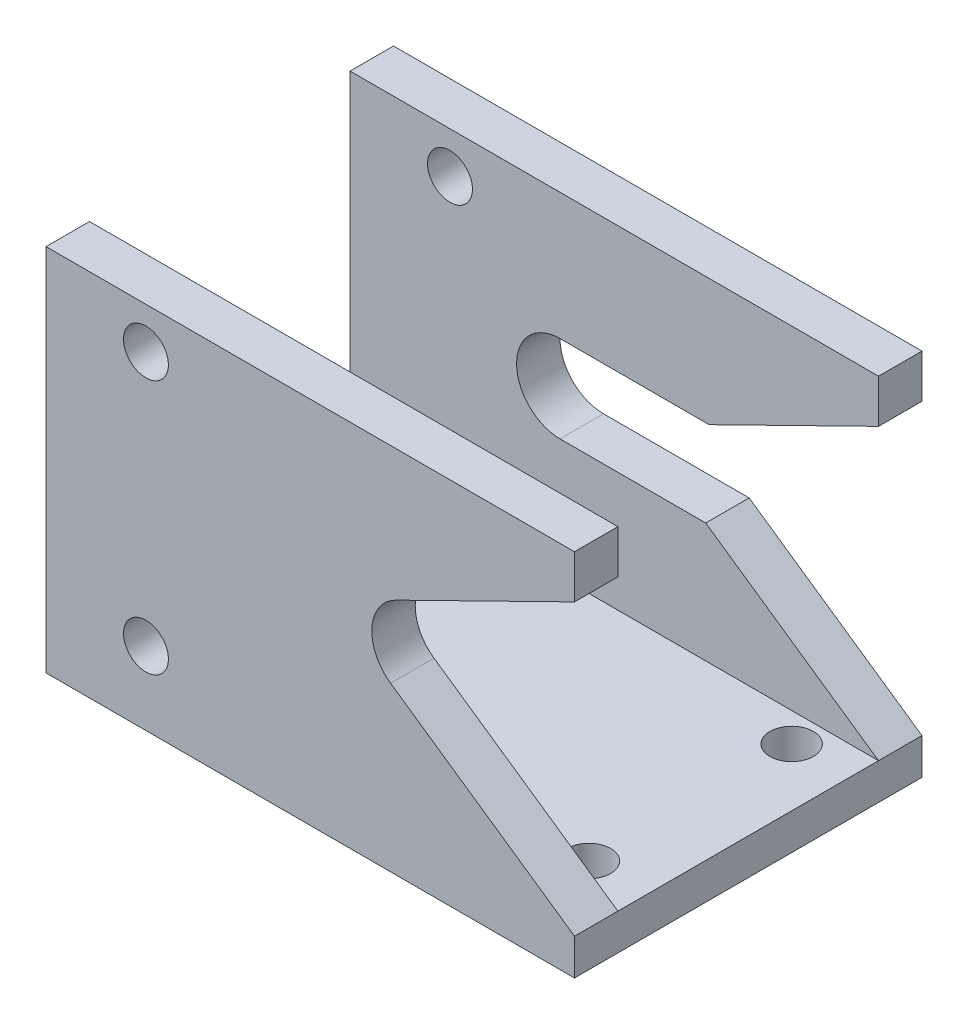
from build123d import *

# Parameters (mm, degrees)
SKETCH1_W           = 36.5
SKETCH1_H           = 24
BOSS_EXTRUDE1_DEPTH = 2.5
SKETCH2_W           = 36.5
SKETCH2_H           = 3
BOSS_EXTRUDE2_DEPTH = 23
SKETCH3_R           = 3
SKETCH3_R_2         = 1.55
CUT_EXTRUDE2_DEPTH  = 51.581617214
SKETCH6_R           = 1.5
CUT_EXTRUDE4_DEPTH  = 50.368512232
CUT_EXTRUDE5_REACH  = 52.582


with BuildPart() as part:
    # Sketch1 → Boss-Extrude1 (new body)
    with BuildSketch(Plane(origin=(0, 0, 0), x_dir=(1, 0, 0), z_dir=(0, 1, 0))):
        with Locations((18.25, 12)):
            Rectangle(SKETCH1_W, SKETCH1_H)
    extrude(amount=BOSS_EXTRUDE1_DEPTH)

    # Sketch2 → Boss-Extrude2 (add)
    with BuildSketch(Plane(origin=(0, 2.5, 0), x_dir=(1, 0, 0), z_dir=(0, 1, 0))):
        with Locations((18.25, 1.5)):
            Rectangle(SKETCH2_W, SKETCH2_H)
        with Locations((18.25, 22.5)):
            Rectangle(SKETCH2_W, SKETCH2_H)
    extrude(amount=BOSS_EXTRUDE2_DEPTH)

    # Sketch3 → Cut-Extrude2 (cut, through all)
    with BuildSketch(Plane.XY):
        with Locations((25.5, 13.75)):
            Circle(SKETCH3_R)
        with BuildLine():
            Line((36.5, 2.5), (36.5, 22.497165255))
            Line((36.5, 22.497165255), (24.17707002, 16.442555713))
            ThreePointArc((24.17707002, 16.442555713), (27.086065897, 16.29644752), (28.5, 13.75))
            ThreePointArc((28.5, 13.75), (26.893321833, 11.093187197), (23.794230487, 11.282136477))
            Line((23.794230487, 11.282136477), (36.5, 2.5))
        make_face()
        with Locations((6.9, 22.65)):
            Circle(SKETCH3_R_2)
        with Locations((6.9, 5.05)):
            Circle(SKETCH3_R_2)
    extrude(amount=-CUT_EXTRUDE2_DEPTH, mode=Mode.SUBTRACT)

    # Sketch6 → Cut-Extrude4 (cut, through all)
    with BuildSketch(Plane(origin=(0, 2.5, 0), x_dir=(1, 0, 0), z_dir=(0, 1, 0))):
        with Locations(Location((4, 19, 0), (0, 0, 270))):
            Circle(SKETCH6_R)
        with Locations(Location((32.5, 19, 0), (0, 0, 90))):
            Circle(SKETCH6_R)
        with Locations(Location((32.5, 5, 0), (0, 0, 270))):
            Circle(SKETCH6_R)
        with Locations(Location((4, 5, 0), (0, 0, 90))):
            Circle(SKETCH6_R)
    extrude(amount=-CUT_EXTRUDE4_DEPTH, mode=Mode.SUBTRACT)

    # Sketch8 → Cut-Extrude5 (cut, up to next)
    with BuildSketch(Plane(origin=(0, 0, -24), x_dir=(-1, 0, 0), z_dir=(0, 0, -1)), mode=Mode.PRIVATE) as cut_extrude5_sk1:
        with BuildLine():
            Line((-24.564111876, 10.75), (-14.5, 10.75))
            ThreePointArc((-14.5, 10.75), (-11.5, 13.75), (-14.5, 16.75))
            Line((-14.5, 16.75), (-24.802810523, 16.75))
            Line((-24.802810523, 16.75), (-24.17707002, 16.442555713))
            ThreePointArc((-24.17707002, 16.442555713), (-22.508221795, 13.971953085), (-23.794230487, 11.282136477))
            Line((-23.794230487, 11.282136477), (-24.564111876, 10.75))
        make_face()
    cut_extrude5_tool1 = extrude(cut_extrude5_sk1.sketch, amount=-CUT_EXTRUDE5_REACH, mode=Mode.PRIVATE) & part.part
    add(cut_extrude5_tool1.solids().sort_by_distance((17.630744, 13.752153, -24))[0], mode=Mode.SUBTRACT)


solid = part.part
